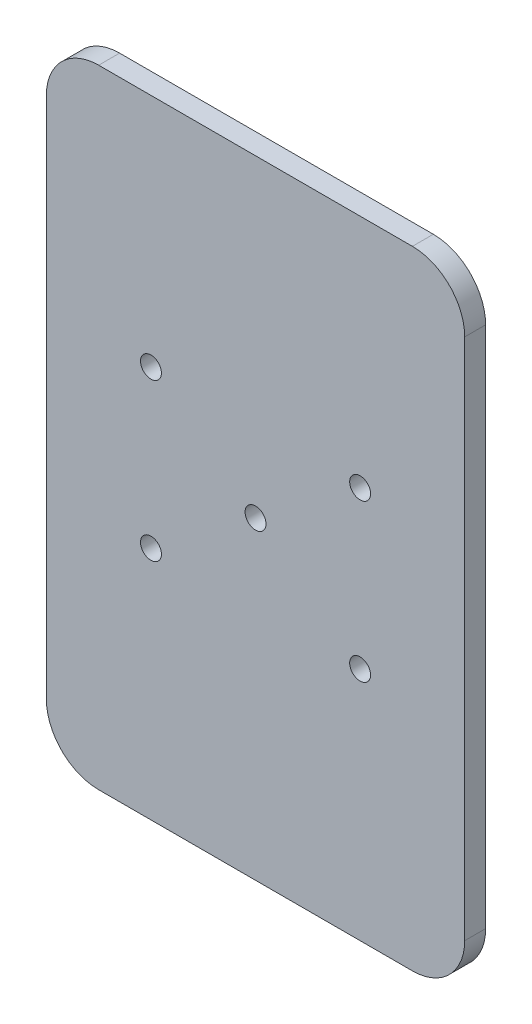
from build123d import *

# Parameters (mm, degrees)
SKETCH1_W               = 40
SKETCH1_H               = 60
BOSS_EXTRUDE4_DEPTH     = 2
FILLET1_R               = 5
SKETCH12_R              = 1
CUT_EXTRUDE6_DEPTH      = 12
CUT_EXTRUDE7_DEPTH      = 8
CUT_EXTRUDE7_DEPTH_BACK = 10
SKETCH13_R              = 1
SKETCH14_R              = 1
CUT_EXTRUDE8_DEPTH      = 10


with BuildPart() as part:
    # Sketch1 → Boss-Extrude4 (new body)
    with BuildSketch(Plane.XY):
        with Locations((-45.9850693, -3.193565597)):
            Rectangle(SKETCH1_W, SKETCH1_H)
    extrude(amount=-BOSS_EXTRUDE4_DEPTH)

    # Fillet1
    fillet1_edges = [part.edges().sort_by_distance(p)[0] for p in [
        (-65.9850693, 26.806434403, -1),
        (-65.9850693, -33.193565597, -1),
        (-25.9850693, -33.193565597, -1),
        (-25.9850693, 26.806434403, -1),
    ]]
    fillet(fillet1_edges, radius=FILLET1_R)

    # Sketch12 → Cut-Extrude6 (cut)
    with BuildSketch(Plane(origin=(0, 0, -2), x_dir=(-1, 0, 0), z_dir=(0, 0, -1))):
        with Locations((45.9850693, -3.193565597)):
            Circle(SKETCH12_R)
    extrude(amount=-CUT_EXTRUDE6_DEPTH, mode=Mode.SUBTRACT)

    # Sketch13 → Cut-Extrude7 (cut, two sides: drawn at the far end of the back side and taken through both)
    with BuildSketch(Plane(origin=(0, 0, -2), x_dir=(-1, 0, 0), z_dir=(0, 0, -1)).offset(-CUT_EXTRUDE7_DEPTH_BACK)):
        with Locations((55.9850693, 4.306434403)):
            Circle(SKETCH13_R)
        with Locations((55.9850693, -10.693565597)):
            Circle(SKETCH13_R)
    extrude(amount=CUT_EXTRUDE7_DEPTH + CUT_EXTRUDE7_DEPTH_BACK, mode=Mode.SUBTRACT)

    # Sketch14 → Cut-Extrude8 (cut)
    with BuildSketch(Plane.XY):
        with Locations((-35.9850693, 4.306434403)):
            Circle(SKETCH14_R)
        with Locations((-35.9850693, -10.693565597)):
            Circle(SKETCH14_R)
    extrude(amount=-CUT_EXTRUDE8_DEPTH, mode=Mode.SUBTRACT)


solid = part.part
